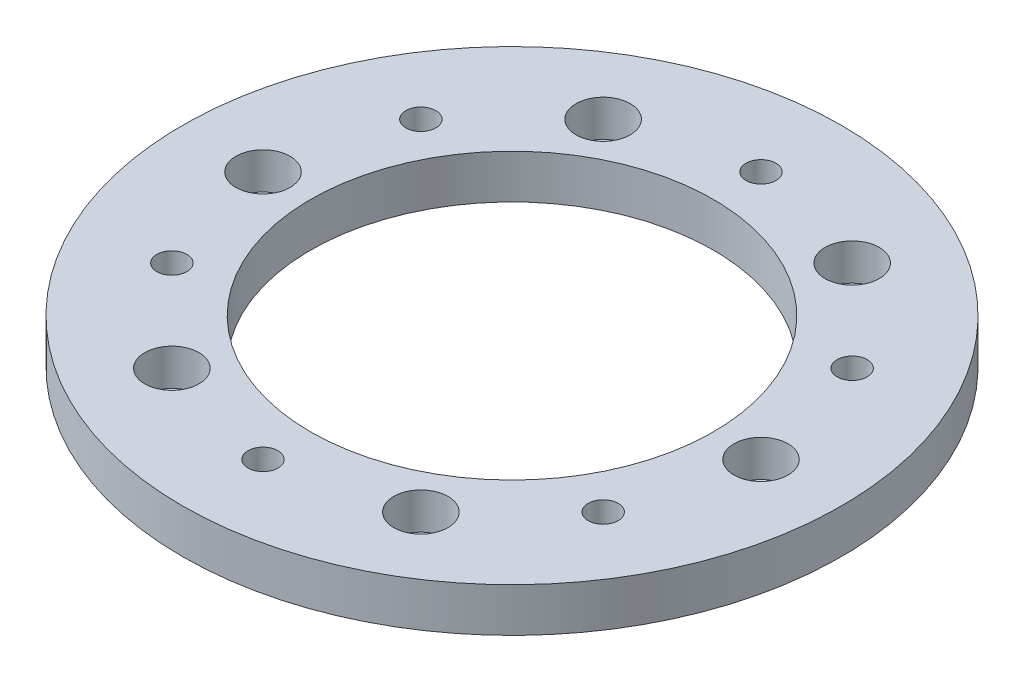
from build123d import *

# Parameters (mm, degrees)
SKETCH_1_R          = 45
SKETCH_1_R_2        = 2.05
SKETCH_1_R_3        = 27.5
EXTRUDE_1_DEPTH     = 6
SKETCH_2_R          = 3.7
CUT_EXTRUDE_1_DEPTH = 5


with BuildPart() as part:
    # 草图1 → 凸台-拉伸1 (new body)
    with BuildSketch(Plane(origin=(0, 0, 0), x_dir=(1, 0, 0), z_dir=(0, 1, 0))):
        with Locations(Location((0, 0, 0), (0, 0, 270))):
            Circle(SKETCH_1_R)
        with Locations(Location((34, 0, 0), (0, 0, 270))):
            Circle(SKETCH_1_R_2, mode=Mode.SUBTRACT)
        with Locations(Location((29.444863729, -17, 0), (0, 0, 270))):
            Circle(SKETCH_1_R_2, mode=Mode.SUBTRACT)
        with Locations(Location((17, -29.444863729, 0), (0, 0, 270))):
            Circle(SKETCH_1_R_2, mode=Mode.SUBTRACT)
        with Locations(Location((0, -34, 0), (0, 0, 270))):
            Circle(SKETCH_1_R_2, mode=Mode.SUBTRACT)
        with Locations(Location((-17, -29.444863729, 0), (0, 0, 270))):
            Circle(SKETCH_1_R_2, mode=Mode.SUBTRACT)
        with Locations(Location((-29.444863729, -17, 0), (0, 0, 270))):
            Circle(SKETCH_1_R_2, mode=Mode.SUBTRACT)
        with Locations(Location((-34, 0, 0), (0, 0, 270))):
            Circle(SKETCH_1_R_2, mode=Mode.SUBTRACT)
        with Locations(Location((-29.444863729, 17, 0), (0, 0, 270))):
            Circle(SKETCH_1_R_2, mode=Mode.SUBTRACT)
        with Locations(Location((-17, 29.444863729, 0), (0, 0, 270))):
            Circle(SKETCH_1_R_2, mode=Mode.SUBTRACT)
        with Locations(Location((0, 34, 0), (0, 0, 270))):
            Circle(SKETCH_1_R_2, mode=Mode.SUBTRACT)
        with Locations(Location((17, 29.444863729, 0), (0, 0, 270))):
            Circle(SKETCH_1_R_2, mode=Mode.SUBTRACT)
        with Locations(Location((29.444863729, 17, 0), (0, 0, 270))):
            Circle(SKETCH_1_R_2, mode=Mode.SUBTRACT)
        with Locations(Location((0, 0, 0), (0, 0, 270))):
            Circle(SKETCH_1_R_3, mode=Mode.SUBTRACT)
    extrude(amount=EXTRUDE_1_DEPTH)

    # 草图2 → 切除-拉伸1 (cut)
    with BuildSketch(Plane(origin=(0, 6, 0), x_dir=(1, 0, 0), z_dir=(0, 1, 0))):
        with Locations(Location((34, 0, 0), (0, 0, 270))):
            Circle(SKETCH_2_R)
        with Locations(Location((17, -29.444863729, 0), (0, 0, 270))):
            Circle(SKETCH_2_R)
        with Locations(Location((-17, -29.444863729, 0), (0, 0, 270))):
            Circle(SKETCH_2_R)
        with Locations(Location((-34, 0, 0), (0, 0, 270))):
            Circle(SKETCH_2_R)
        with Locations(Location((-17, 29.444863729, 0), (0, 0, 270))):
            Circle(SKETCH_2_R)
        with Locations(Location((17, 29.444863729, 0), (0, 0, 270))):
            Circle(SKETCH_2_R)
    extrude(amount=-CUT_EXTRUDE_1_DEPTH, mode=Mode.SUBTRACT)


solid = part.part
